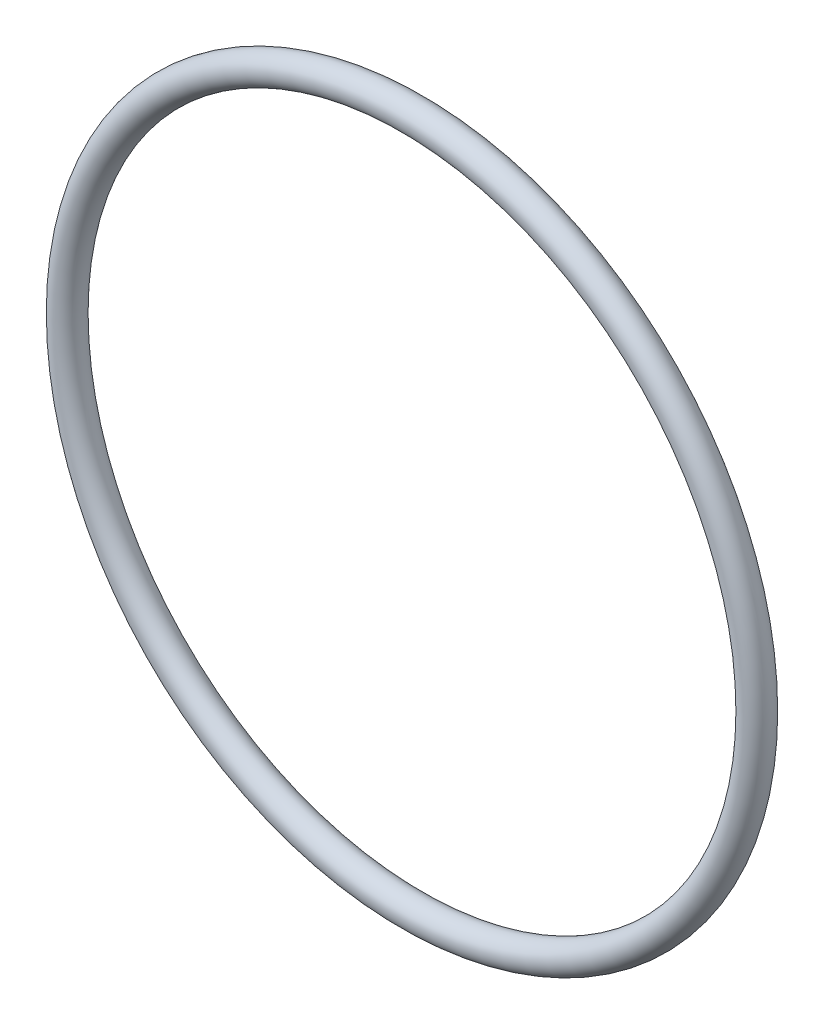
from build123d import *

# Parameters (mm, degrees)
SKETCH1_R = 1.3081


with BuildPart() as part:
    # Sketch1 → Revolve1 (revolve)
    with BuildSketch(Plane(origin=(0, 0, 0), x_dir=(0, -1, 0), z_dir=(1, 0, 0)), mode=Mode.PRIVATE) as revolve1_sk:
        with Locations((30.5181, 0)):
            Circle(SKETCH1_R)
    revolve(revolve1_sk.sketch.rotate(Axis((0, 0, 1.3081), (0, 0, -1)), 270), axis=Axis((0, 0, 1.3081), (0, 0, -1)))


solid = part.part
